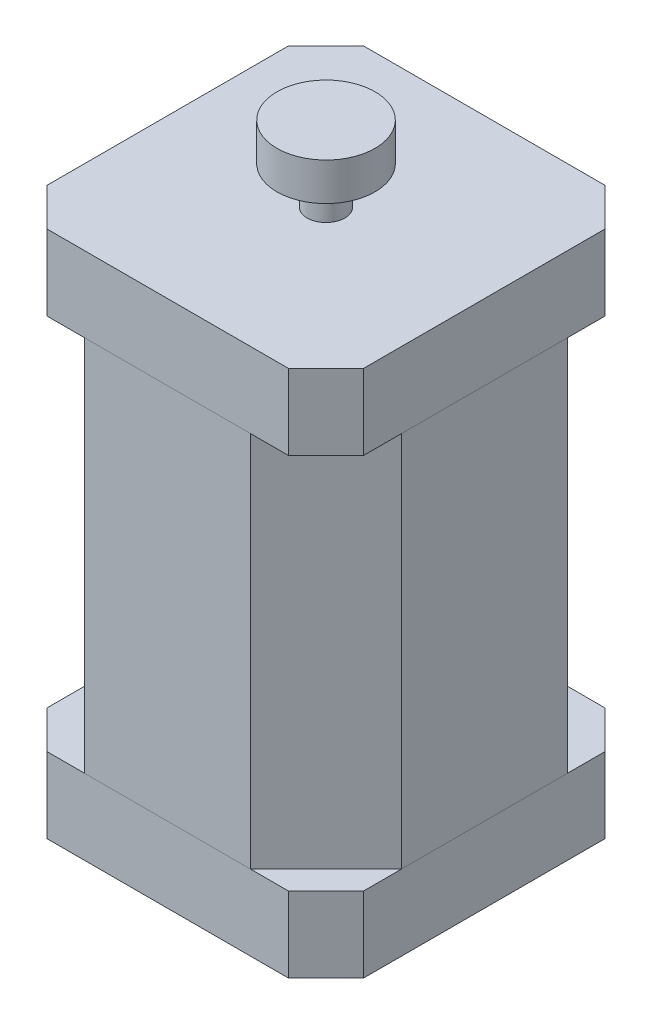
from build123d import *

# Parameters (mm, degrees)
SKETCH_1_W      = 42
SKETCH_1_H      = 50
EXTRUDE_1_DEPTH = 42
CHAMFER_1_SIZE  = 10
SKETCH_2_W      = 42
SKETCH_2_H      = 42
EXTRUDE_2_DEPTH = 10
SKETCH_3_W      = 42
SKETCH_3_H      = 42
EXTRUDE_3_DEPTH = 10
CHAMFER_2_SIZE  = 5
CHAMFER_3_SIZE  = 5
SKETCH_4_R      = 2.5
EXTRUDE_4_DEPTH = 10
SKETCH_5_R      = 6.5
EXTRUDE_5_DEPTH = 5


with BuildPart() as part:
    # 草圖1 → 填料-伸長1 (new body)
    with BuildSketch(Plane.XY):
        with Locations((21, 25)):
            Rectangle(SKETCH_1_W, SKETCH_1_H)
    extrude(amount=EXTRUDE_1_DEPTH)

    # 導角1
    chamfer_1_edges = [part.edges().sort_by_distance(p)[0] for p in [
        (42, 25, 42),
        (0, 25, 42),
        (42, 25, 0),
        (0, 25, 0),
    ]]
    chamfer(chamfer_1_edges, length=CHAMFER_1_SIZE)


with BuildPart() as body_2:
    # 草圖2 → 填料-伸長2 (new body)
    with BuildSketch(Plane(origin=(0, 50, 0), x_dir=(1, 0, 0), z_dir=(0, 1, 0))):
        with Locations((21, -21)):
            Rectangle(SKETCH_2_W, SKETCH_2_H)
    extrude(amount=EXTRUDE_2_DEPTH)

    # 導角2
    chamfer_2_edges = [body_2.edges().sort_by_distance(p)[0] for p in [
        (0, 55, 0),
        (42, 55, 0),
        (42, 55, 42),
        (0, 55, 42),
    ]]
    chamfer(chamfer_2_edges, length=CHAMFER_2_SIZE)

    # 草圖4 → 填料-伸長4 (add)
    with BuildSketch(Plane(origin=(0, 60, 0), x_dir=(1, 0, 0), z_dir=(0, 1, 0))):
        with Locations(Location((21, -21, 0), (0, 0, 90))):
            Circle(SKETCH_4_R)
    extrude(amount=EXTRUDE_4_DEPTH)

    # 草圖5 → 填料-伸長5 (add)
    with BuildSketch(Plane(origin=(0, 70, 0), x_dir=(1, 0, 0), z_dir=(0, 1, 0))):
        with Locations(Location((21, -21, 0), (0, 0, 270))):
            Circle(SKETCH_5_R)
    extrude(amount=-EXTRUDE_5_DEPTH)


with BuildPart() as body_3:
    # 草圖3 → 填料-伸長3 (new body)
    with BuildSketch(Plane.XZ):
        with Locations((21, 21)):
            Rectangle(SKETCH_3_W, SKETCH_3_H)
    extrude(amount=EXTRUDE_3_DEPTH)

    # 導角3
    chamfer_3_edges = [body_3.edges().sort_by_distance(p)[0] for p in [
        (0, -5, 42),
        (42, -5, 42),
        (42, -5, 0),
        (0, -5, 0),
    ]]
    chamfer(chamfer_3_edges, length=CHAMFER_3_SIZE)


solid = Compound([part.part, body_2.part, body_3.part])
